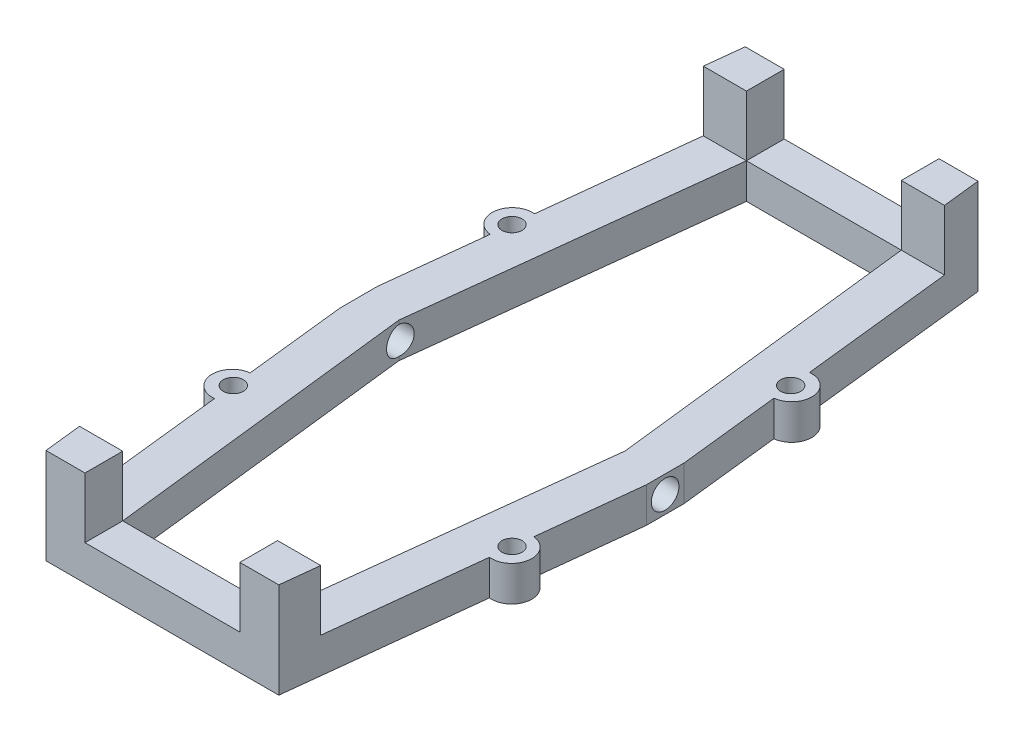
from build123d import *

# Parameters (mm, degrees)
BOSS_EXTRUDE1_DEPTH = 3.5
SKETCH2_R           = 1.375
CUT_EXTRUDE1_DEPTH  = 47.767592889
BOSS_EXTRUDE5_DEPTH = 6
SKETCH9_R           = 1
CUT_EXTRUDE2_DEPTH  = 10


with BuildPart() as part:
    # Sketch1 → Boss-Extrude1 (new body)
    with BuildSketch(Plane(origin=(0, 0, 0), x_dir=(1, 0, 0), z_dir=(0, 1, 0))):
        with BuildLine():
            Line((5.65, -1.875), (5.65, 1.875))
            Line((5.65, 1.875), (1.9, 1.875))
            Line((1.9, 1.875), (-1.875, -31))
            Line((-1.875, -31), (-17.265, -31))
            Line((-17.265, -31), (-21.04, 1.875))
            Line((-21.04, 1.875), (-24.79, 1.875))
            Line((-24.79, 1.875), (-24.79, -1.875))
            Line((-24.79, -1.875), (-23.673675208, -11.929569188))
            ThreePointArc((-23.673675208, -11.929569188), (-25.440763963, -14.138052226), (-23.232280925, -15.905140982))
            Line((-23.232280925, -15.905140982), (-21.14, -34.75))
            Line((-21.14, -34.75), (-19.14, -34.75))
            Line((-19.14, -34.75), (0, -34.75))
            Line((0, -34.75), (2, -34.75))
            Line((2, -34.75), (4.092280925, -15.905140982))
            ThreePointArc((4.092280925, -15.905140982), (6.300763963, -14.138052226), (4.533675208, -11.929569188))
            Line((4.533675208, -11.929569188), (5.65, -1.875))
        make_face()
    boss_extrude1 = extrude(amount=BOSS_EXTRUDE1_DEPTH)

    # Sketch2 → Cut-Extrude1 (cut, through all)
    with BuildSketch(Plane(origin=(5.65, 0, 0), x_dir=(0, 0, -1), z_dir=(1, 0, 0))):
        with Locations((0, 1.75)):
            Circle(SKETCH2_R)
    cut_extrude1 = extrude(amount=-CUT_EXTRUDE1_DEPTH, mode=Mode.SUBTRACT)

    # Sketch7 → Boss-Extrude5 (add)
    with BuildSketch(Plane(origin=(0, 3.5, 0), x_dir=(1, 0, 0), z_dir=(0, 1, 0))):
        Polygon((-1.875, -31), (-1.875, -34.75), (2, -34.75), (2.41634981, -31), align=None)
        Polygon((-21.55634981, -31), (-17.265, -31), (-17.265, -34.75), (-21.14, -34.75), align=None)
    boss_extrude5 = extrude(amount=BOSS_EXTRUDE5_DEPTH)

    # Mirror46: Boss-Extrude1, Cut-Extrude1, Boss-Extrude5 across plane
    add(boss_extrude1.mirror(Plane.XY))
    add(cut_extrude1.mirror(Plane.XY), mode=Mode.SUBTRACT)
    add(boss_extrude5.mirror(Plane.XY))

    # Sketch9 → Cut-Extrude2 (cut)
    with BuildSketch(Plane(origin=(0, 3.5, 0), x_dir=(1, 0, 0), z_dir=(0, 1, 0))):
        with Locations(Location((4.28, 13.85, 0), (0, 0, 270))):
            Circle(SKETCH9_R)
        with Locations(Location((-23.42, 13.85, 0), (0, 0, 270))):
            Circle(SKETCH9_R)
        with Locations(Location((-23.42, -13.85, 0), (0, 0, 270))):
            Circle(SKETCH9_R)
        with Locations(Location((4.28, -13.85, 0), (0, 0, 270))):
            Circle(SKETCH9_R)
    extrude(amount=-CUT_EXTRUDE2_DEPTH, mode=Mode.SUBTRACT)


solid = part.part
